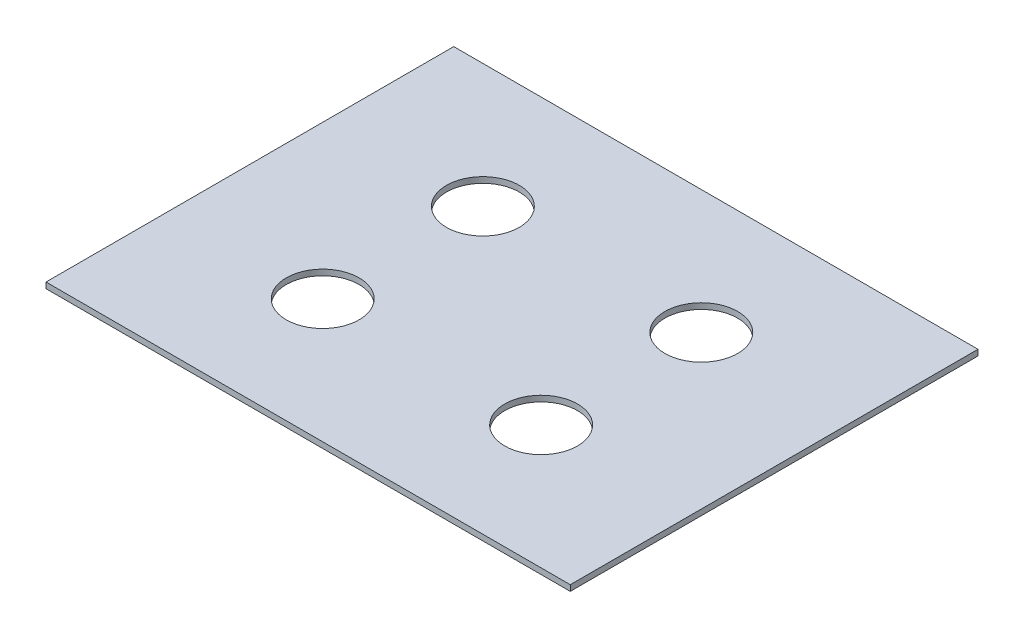
from build123d import *

# Parameters (mm, degrees)
SKETCH1_W           = 228.6
SKETCH1_H           = 177.8
BOSS_EXTRUDE1_DEPTH = 2.54
SKETCH2_R           = 15.875
CUT_EXTRUDE1_DEPTH  = 145.824554548


with BuildPart() as part:
    # Sketch1 → Boss-Extrude1 (new body)
    with BuildSketch(Plane(origin=(0, 0, 0), x_dir=(1, 0, 0), z_dir=(0, 1, 0))):
        Rectangle(SKETCH1_W, SKETCH1_H)
    extrude(amount=BOSS_EXTRUDE1_DEPTH)

    # Sketch2 → Cut-Extrude1 (cut, through all)
    with BuildSketch(Plane(origin=(0, 2.54, 0), x_dir=(1, 0, 0), z_dir=(0, 1, 0))):
        with Locations(Location((-47.625, 34.925, 0), (0, 0, 270))):
            Circle(SKETCH2_R)
        with Locations(Location((47.625, 34.925, 0), (0, 0, 270))):
            Circle(SKETCH2_R)
        with Locations(Location((47.625, -34.925, 0), (0, 0, 270))):
            Circle(SKETCH2_R)
        with Locations(Location((-47.625, -34.925, 0), (0, 0, 270))):
            Circle(SKETCH2_R)
    extrude(amount=-CUT_EXTRUDE1_DEPTH, mode=Mode.SUBTRACT)


solid = part.part
